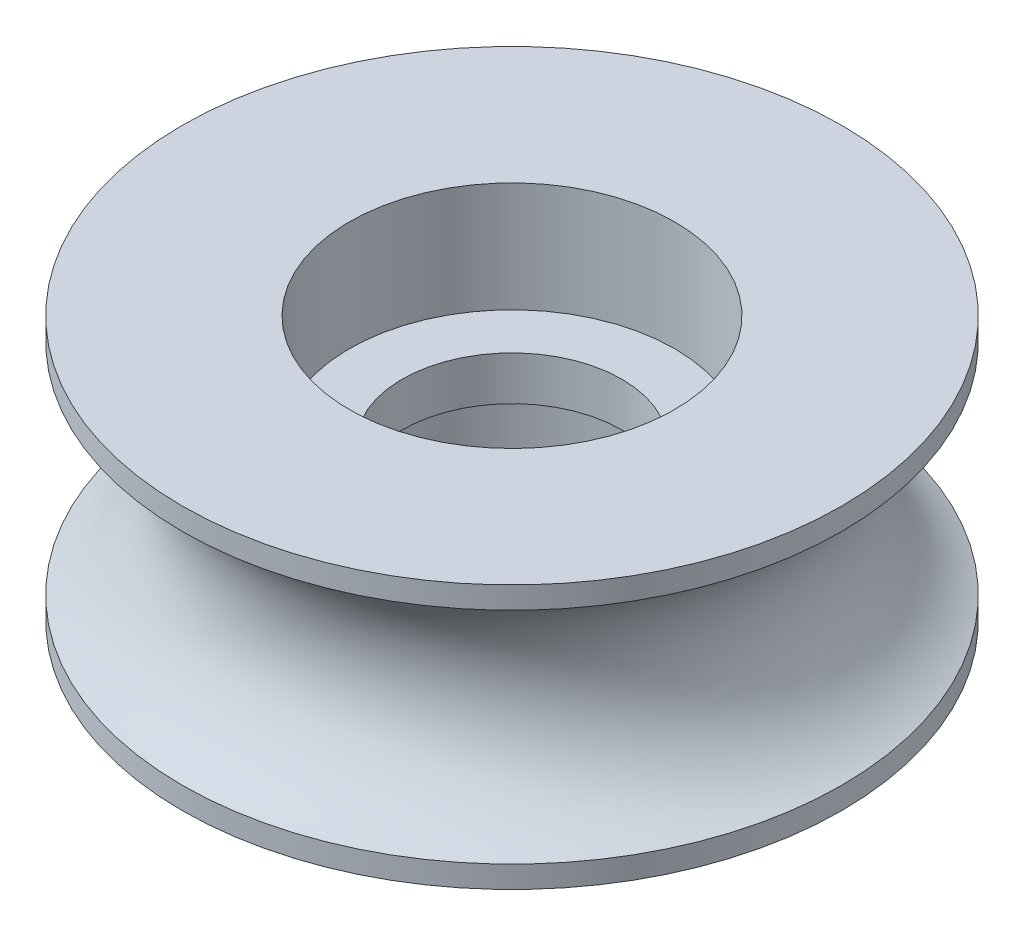
from build123d import *


with BuildPart() as part:
    # Sketch1 → Revolve1 (revolve)
    with BuildSketch(Plane.XY, mode=Mode.PRIVATE) as revolve1_sk:
        with BuildLine():
            Line((-3.7, 0), (-7.5, 0))
            Line((-7.5, 0), (-7.5, 0.5))
            ThreePointArc((-7.5, 0.5), (-5.819803903, 3), (-7.5, 5.5))
            Line((-7.5, 5.5), (-7.5, 6))
            Line((-7.5, 6), (-3.7, 6))
            Line((-3.7, 6), (-3.7, 3.5))
            Line((-3.7, 3.5), (-2.5, 3.5))
            Line((-2.5, 3.5), (-2.5, 2.5))
            Line((-2.5, 2.5), (-3.7, 2.5))
            Line((-3.7, 2.5), (-3.7, 0))
        make_face()
    revolve(revolve1_sk.sketch.rotate(Axis((0, -6.629530881, 0), (0, 1, 0)), 270), axis=Axis((0, -6.629530881, 0), (0, 1, 0)))


solid = part.part
